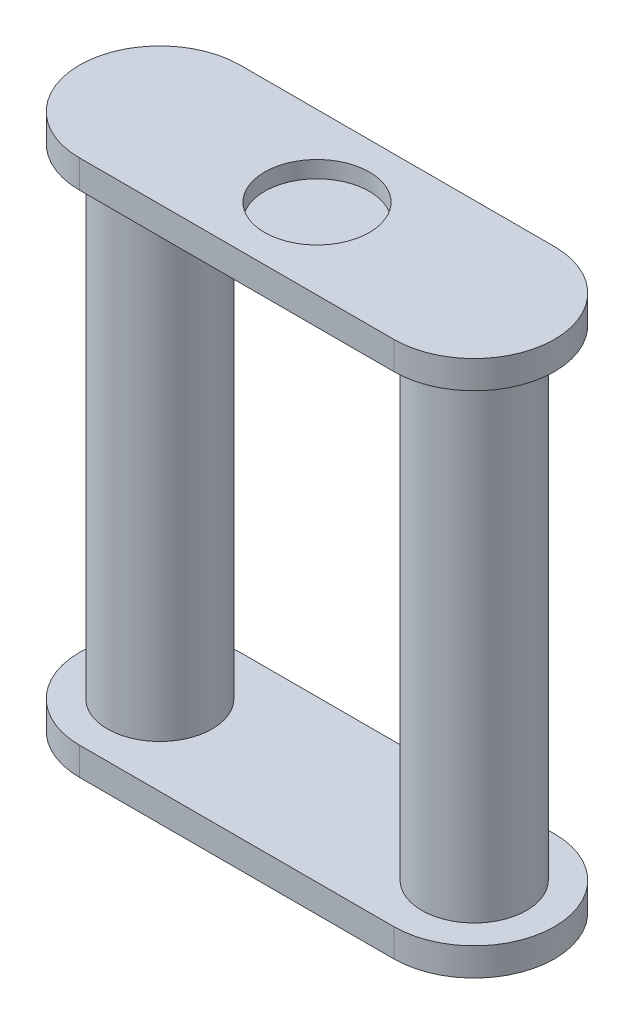
from build123d import *

# Parameters (mm, degrees)
BOSS_EXTRUDE1_DEPTH = 40
SKETCH2_R           = 75
BOSS_EXTRUDE2_DEPTH = 688
SKETCH3_R           = 75
BOSS_EXTRUDE3_DEPTH = 1
SKETCH5_R           = 75
CUT_EXTRUDE1_DEPTH  = 25


with BuildPart() as part:
    # Sketch1 → Boss-Extrude1 (new body)
    with BuildSketch(Plane(origin=(0, 0, 0), x_dir=(1, 0, 0), z_dir=(0, 1, 0))):
        with BuildLine():
            Line((0, 0), (450, 0))
            ThreePointArc((450, 0), (565, 115), (450, 230))
            Line((450, 230), (0, 230))
            ThreePointArc((0, 230), (-115, 115), (0, 0))
        make_face()
    boss_extrude1 = extrude(amount=BOSS_EXTRUDE1_DEPTH)

    # Sketch2 → Boss-Extrude2 (add)
    with BuildSketch(Plane(origin=(0, 40, 0), x_dir=(1, 0, 0), z_dir=(0, 1, 0))):
        with Locations(Location((0, 115, 0), (0, 0, 270))):
            Circle(SKETCH2_R)
        with Locations(Location((450, 115, 0), (0, 0, 270))):
            Circle(SKETCH2_R)
    extrude(amount=BOSS_EXTRUDE2_DEPTH)

    # Mirror1: Boss-Extrude1 across plane
    add(boss_extrude1.mirror(Plane.ZX.offset(384)))

    # Sketch3 → Boss-Extrude3 (add)
    with BuildSketch(Plane(origin=(0, 768, 0), x_dir=(1, 0, 0), z_dir=(0, 1, 0))):
        with Locations(Location((225, 115, 0), (0, 0, 270))):
            Circle(SKETCH3_R)
    boss_extrude3 = extrude(amount=BOSS_EXTRUDE3_DEPTH)

    # Mirror2: Boss-Extrude3 across plane
    add(boss_extrude3.mirror(Plane.ZX.offset(384)))

    # Sketch5 → Cut-Extrude1 (cut)
    with BuildSketch(Plane(origin=(0, 769, 0), x_dir=(1, 0, 0), z_dir=(0, 1, 0))):
        with Locations(Location((225, 115, 0), (0, 0, 270))):
            Circle(SKETCH5_R)
    cut_extrude1 = extrude(amount=-CUT_EXTRUDE1_DEPTH, mode=Mode.SUBTRACT)

    # Mirror3: Cut-Extrude1 across plane
    add(cut_extrude1.mirror(Plane.ZX.offset(384)), mode=Mode.SUBTRACT)


solid = part.part
